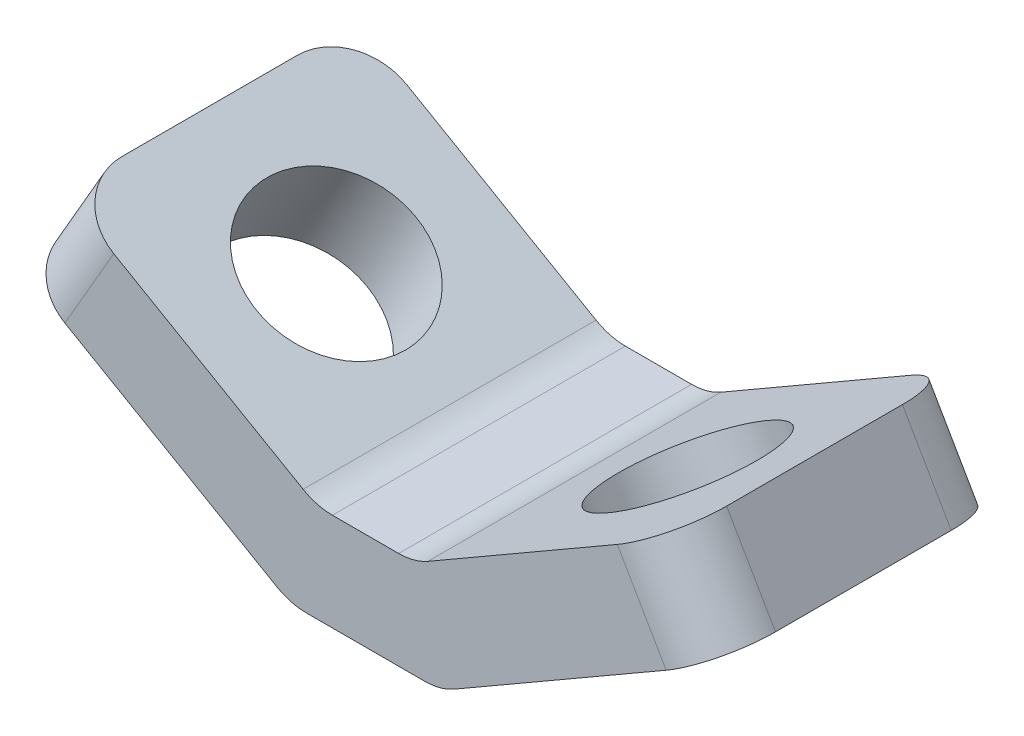
from build123d import *

# Parameters (mm, degrees)
EXTRUDE_1_DEPTH          = 7.5
CUT_EXTRUDE_1_DEPTH      = 27.249846584
CUT_EXTRUDE_1_DEPTH_BACK = 27.249846584
SKETCH_2_R               = 4.1
CUT_EXTRUDE_2_DEPTH      = 27.516200545
CUT_EXTRUDE_2_DEPTH_BACK = 27.516200545
SKETCH_3_R               = 4.1
FILLET_1_R               = 3


with BuildPart() as part:
    # ｽｹｯﾁ1 → ﾎﾞｽ - 押し出し1 (new, symmetric)
    with BuildSketch(Plane.XY):
        Polygon((0, 0), (-14.150635095, 8.169872981), (-11.650635095, 12.5), (1.339745962, 5), (6.339745962, 5), (19.330127019, 12.5), (21.830127019, 8.169872981), (7.679491924, 0), align=None)
    extrude(amount=EXTRUDE_1_DEPTH, both=True)

    # ｽｹｯﾁ2 → ｶｯﾄ - 押し出し1 (cut, two sides: drawn at the far end of the back side and taken through both)
    with BuildSketch(Plane(origin=(0, 0, 0), x_dir=(0, 0, 1), z_dir=(-0.5000000000000012, -0.866025403784438, 0)).offset(-CUT_EXTRUDE_1_DEPTH_BACK)):
        with Locations(Location((0, 8.839745962, 0), (0, 0, 270))):
            Circle(SKETCH_2_R)
    extrude(amount=CUT_EXTRUDE_1_DEPTH + CUT_EXTRUDE_1_DEPTH_BACK, mode=Mode.SUBTRACT)

    # ｽｹｯﾁ3 → ｶｯﾄ - 押し出し2 (cut, two sides: drawn at the far end of the back side and taken through both)
    with BuildSketch(Plane(origin=(1.919872981, -3.325317547, 0), x_dir=(0, 0, -1), z_dir=(0.5000000000000013, -0.8660254037844379, 0)).offset(-CUT_EXTRUDE_2_DEPTH_BACK)):
        with Locations(Location((0, 15.490381057, 0), (0, 0, 90))):
            Circle(SKETCH_3_R)
    extrude(amount=CUT_EXTRUDE_2_DEPTH + CUT_EXTRUDE_2_DEPTH_BACK, mode=Mode.SUBTRACT)

    # ﾌｨﾚｯﾄ1
    fillet_1_edges = [part.edges().sort_by_distance(p)[0] for p in [
        (20.580127019, 10.334936491, -7.5),
        (20.580127019, 10.334936491, 7.5),
        (0, 0, 0),
        (1.339745962, 5, 0),
        (6.339745962, 5, 0),
        (7.679491924, 0, 0),
        (-12.900635095, 10.334936491, 7.5),
        (-12.900635095, 10.334936491, -7.5),
    ]]
    fillet(fillet_1_edges, radius=FILLET_1_R)


solid = part.part
